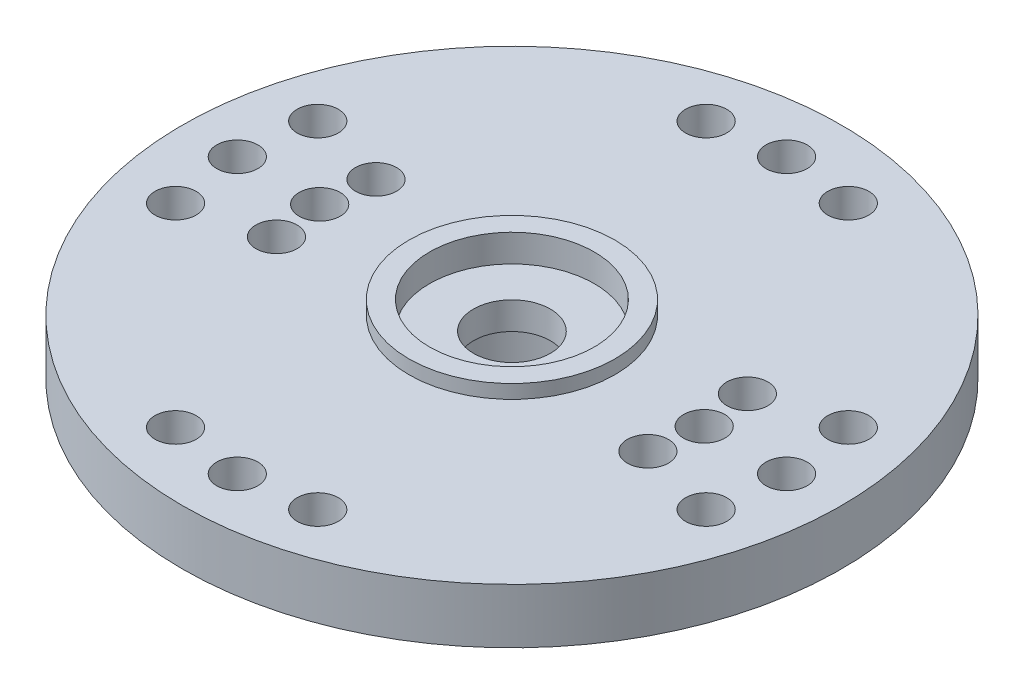
from build123d import *

# Parameters (mm, degrees)
F_1_5_1_5_DIAMETER_HOLE1_D = 1.5
CIRPATTERN1_COUNT          = 4
SKETCH4_R                  = 3
CUT_EXTRUDE1_DEPTH         = 1
CUT_EXTRUDE2_START         = -3
SKETCH5_R                  = 3
CUT_EXTRUDE2_DEPTH         = 3
F_1_5_1_5_DIAMETER_HOLE2_D = 1.5
CIRPATTERN2_COUNT          = 2


with BuildPart() as part:
    # Sketch1 → Revolve1 (revolve)
    with BuildSketch(Plane.XY, mode=Mode.PRIVATE) as revolve1_sk:
        Polygon((-12, 0), (-3.75, 0), (-3.75, 0.5), (-1.4, 0.5), (-1.4, -4.5), (-4.45, -4.5), (-4.45, -2), (-12, -2), align=None)
    revolve(revolve1_sk.sketch.rotate(Axis((0, 0, 0), (0, -1, 0)), 270), axis=Axis((0, 0, 0), (0, -1, 0)))

    # Ø1.5 (1.5) Diameter Hole1 (through all)
    with Locations(Plane(origin=(0, 0, 0), x_dir=(-1, 0, 0), z_dir=(0, 1, 0))):
        with Locations((0, -10), (2.588190451, -9.659258263), (-2.588190451, -9.659258263)):
            f_1_5_1_5_diameter_hole1 = Hole(F_1_5_1_5_DIAMETER_HOLE1_D / 2)

    # CirPattern1: Ø1.5 (1.5) Diameter Hole1 ×4 about axis
    cirpattern1_axis = Axis((0, 0, 0), (0, 1, 0))
    for i in range(1, CIRPATTERN1_COUNT):
        add(f_1_5_1_5_diameter_hole1.rotate(cirpattern1_axis, i * 360 / CIRPATTERN1_COUNT), mode=Mode.SUBTRACT)

    # Sketch4 → Cut-Extrude1 (cut)
    with BuildSketch(Plane(origin=(0, 0.5, 0), x_dir=(-1, 0, 0), z_dir=(0, 1, 0))):
        with Locations(Location((0, 0, 0), (0, 0, 90))):
            Circle(SKETCH4_R)
    extrude(amount=-CUT_EXTRUDE1_DEPTH, mode=Mode.SUBTRACT)

    # Sketch5 → Cut-Extrude2 (cut)
    with BuildSketch(Plane.XZ.offset(4.5).offset(CUT_EXTRUDE2_START)):
        with Locations(Location((0, 0, 0), (0, 0, 90))):
            Circle(SKETCH5_R)
    extrude(amount=CUT_EXTRUDE2_DEPTH, mode=Mode.SUBTRACT)

    # Ø1.5 (1.5) Diameter Hole2 (through all)
    with Locations(Plane(origin=(0, 0, 0), x_dir=(-1, 0, 0), z_dir=(0, 1, 0))):
        with Locations((6.761480784, -1.811733316), (7, 0), (6.761480784, 1.811733316)):
            f_1_5_1_5_diameter_hole2 = Hole(F_1_5_1_5_DIAMETER_HOLE2_D / 2)

    # CirPattern2: Ø1.5 (1.5) Diameter Hole2 ×2 about axis
    cirpattern2_axis = Axis((0, 0, 0), (0, 1, 0))
    for i in range(1, CIRPATTERN2_COUNT):
        add(f_1_5_1_5_diameter_hole2.rotate(cirpattern2_axis, i * 360 / CIRPATTERN2_COUNT), mode=Mode.SUBTRACT)


solid = part.part
